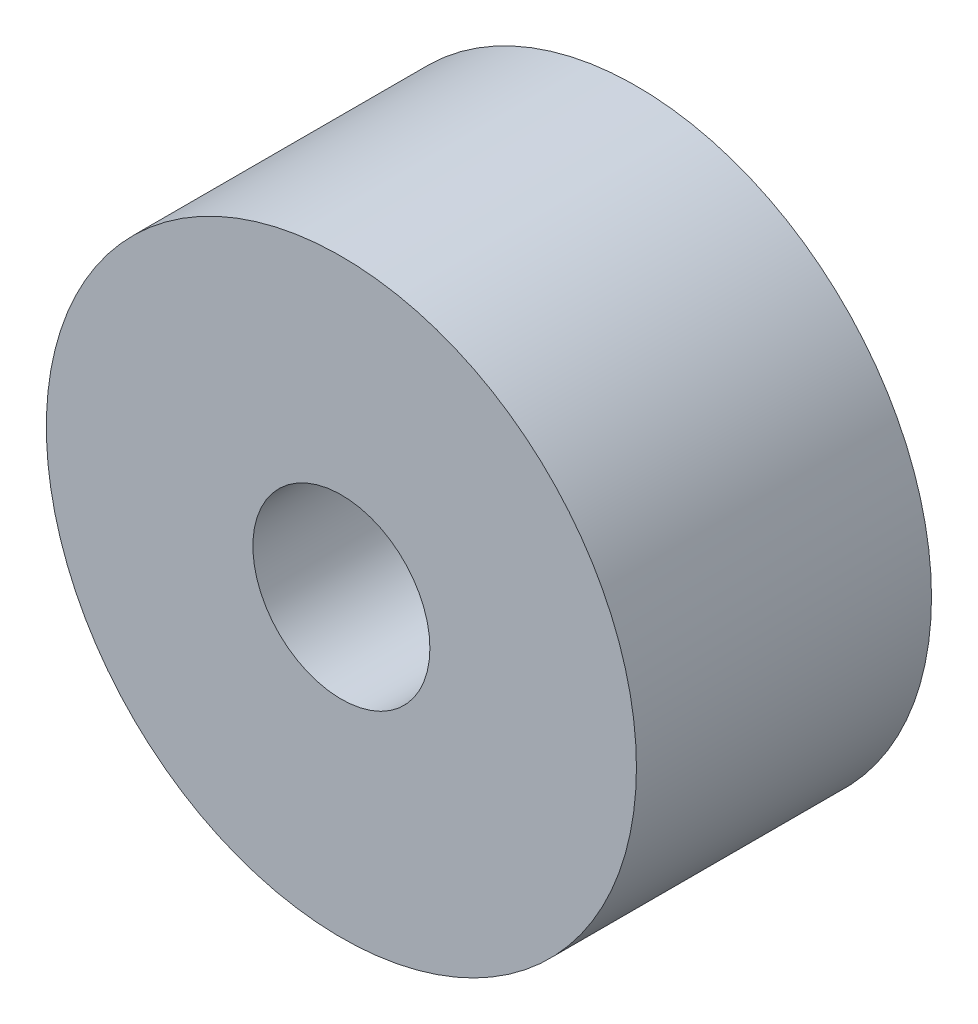
from build123d import *

# Parameters (mm, degrees)
SKETCH_1_R      = 5
SKETCH_1_R_2    = 1.5
EXTRUDE_1_DEPTH = 5


with BuildPart() as part:
    # 草图1 → 凸台-拉伸1 (new body)
    with BuildSketch(Plane.XY):
        Circle(SKETCH_1_R)
        Circle(SKETCH_1_R_2, mode=Mode.SUBTRACT)
    extrude(amount=EXTRUDE_1_DEPTH)


solid = part.part
